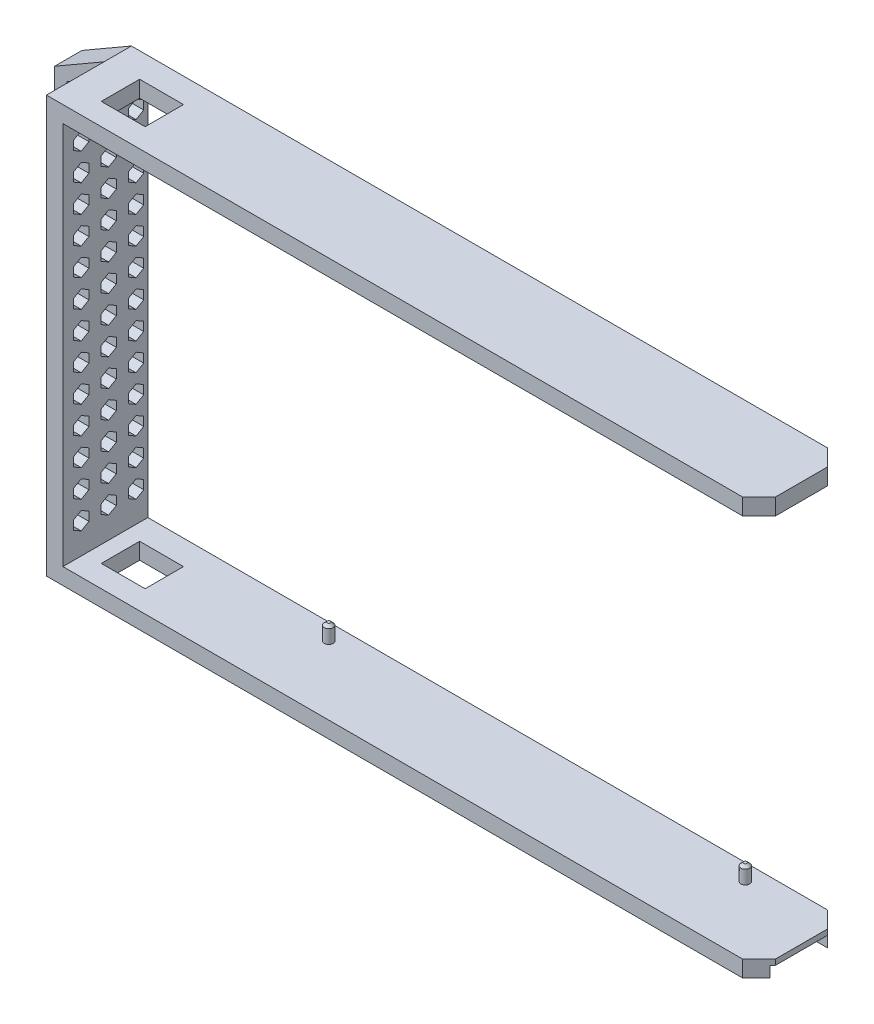
from build123d import *

# Parameters (mm, degrees)
SKETCH1_W           = 127
SKETCH1_H           = 3
SKETCH1_W_2         = 3
SKETCH1_H_2         = 70
BOSS_EXTRUDE1_DEPTH = 15.5
SKETCH2_W           = 22
SKETCH2_H           = 10
CUT_EXTRUDE1_DEPTH  = 2
CHAMFER5_SIZE       = 2
SKETCH3_W           = 2
SKETCH3_H           = 2.5
BOSS_EXTRUDE2_DEPTH = 3
CHAMFER9_SIZE       = 3
CHAMFER10_SIZE      = 3
CHAMFER11_SIZE      = 3
CHAMFER12_SIZE      = 3
SKETCH4_W           = 8
SKETCH4_H           = 7
CUT_EXTRUDE3_DEPTH  = 143
SKETCH10_R          = 0.8
BOSS_EXTRUDE5_DEPTH = 73
SKETCH14_R          = 0.8
BOSS_EXTRUDE6_DEPTH = 73
SKETCH15_W          = 11.145402024
SKETCH15_H          = 32
SKETCH15_W_2        = 9.53887415
CUT_EXTRUDE7_DEPTH  = 73
CHAMFER15_SIZE      = 0.5
CHAMFER16_SIZE      = 0.5
CUT_EXTRUDE8_DEPTH  = 73
BOSS_EXTRUDE9_DEPTH = 5


with BuildPart() as part:
    # Sketch1 → Boss-Extrude1 (new body)
    with BuildSketch(Plane.XY):
        with Locations((66.5, 74.5)):
            Rectangle(SKETCH1_W, SKETCH1_H)
        with Locations((1.5, 74.5)):
            Rectangle(SKETCH1_W_2, SKETCH1_H)
        with Locations((1.5, 38)):
            Rectangle(SKETCH1_W_2, SKETCH1_H_2)
        with Locations((1.5, 1.5)):
            Rectangle(SKETCH1_W_2, SKETCH1_H)
        with Locations((66.5, 1.5)):
            Rectangle(SKETCH1_W, SKETCH1_H)
    extrude(amount=BOSS_EXTRUDE1_DEPTH)

    # Sketch2 → Cut-Extrude1 (cut)
    with BuildSketch(Plane.XZ):
        with Locations((119, 8)):
            Rectangle(SKETCH2_W, SKETCH2_H)
    extrude(amount=-CUT_EXTRUDE1_DEPTH, mode=Mode.SUBTRACT)

    # Chamfer5
    chamfer5_edges = [part.edges().sort_by_distance(p)[0] for p in [
        (130, 1.5, 0),
    ]]
    chamfer(chamfer5_edges, length=CHAMFER5_SIZE)

    # Sketch3 → Boss-Extrude2 (add)
    with BuildSketch(Plane.XZ):
        with Locations((129, 1.25)):
            Rectangle(SKETCH3_W, SKETCH3_H)
    extrude(amount=-BOSS_EXTRUDE2_DEPTH)

    # Chamfer9
    chamfer9_edges = [part.edges().sort_by_distance(p)[0] for p in [
        (130, 1.5, 0),
    ]]
    chamfer(chamfer9_edges, length=CHAMFER9_SIZE)

    # Chamfer10
    chamfer10_edges = [part.edges().sort_by_distance(p)[0] for p in [
        (130, 1.5, 15.5),
    ]]
    chamfer(chamfer10_edges, length=CHAMFER10_SIZE)

    # Chamfer11
    chamfer11_edges = [part.edges().sort_by_distance(p)[0] for p in [
        (130, 74.5, 0),
    ]]
    chamfer(chamfer11_edges, length=CHAMFER11_SIZE)

    # Chamfer12
    chamfer12_edges = [part.edges().sort_by_distance(p)[0] for p in [
        (130, 74.5, 15.5),
    ]]
    chamfer(chamfer12_edges, length=CHAMFER12_SIZE)

    # Sketch4 → Cut-Extrude3 (cut)
    with BuildSketch(Plane(origin=(0, 76, 0), x_dir=(1, 0, 0), z_dir=(0, 1, 0))):
        with Locations((10, -8)):
            Rectangle(SKETCH4_W, SKETCH4_H)
    extrude(amount=-CUT_EXTRUDE3_DEPTH, mode=Mode.SUBTRACT)

    # Sketch10 → Boss-Extrude5 (add)
    with BuildSketch(Plane(origin=(0, 76, 0), x_dir=(1, 0, 0), z_dir=(0, 1, 0))):
        with Locations(Location((115, -3, 0), (0, 0, 270))):
            Circle(SKETCH10_R)
    extrude(amount=-BOSS_EXTRUDE5_DEPTH)

    # Sketch14 → Boss-Extrude6 (add)
    with BuildSketch(Plane(origin=(0, 76, 0), x_dir=(1, 0, 0), z_dir=(0, 1, 0))):
        with Locations(Location((39, -3, 0), (0, 0, 270))):
            Circle(SKETCH14_R)
    extrude(amount=-BOSS_EXTRUDE6_DEPTH)

    # Sketch15 → Cut-Extrude7 (cut)
    with BuildSketch(Plane.XY.offset(15.5)):
        Polygon((76.763159947, 70), (76.763159947, 38), (109.117804389, 38), (115.919411593, 38), (115.919411593, 70), align=None)
        with Locations((121.492112605, 54)):
            Rectangle(SKETCH15_W, SKETCH15_H)
        Polygon((115.919411593, 38), (109.117804389, 38), (109.117804389, 6), (132.054107066, 6), (132.054107066, 38), (127.064813617, 38), align=None)
        with Locations((42.280701989, 22)):
            Rectangle(SKETCH15_W_2, SKETCH15_H)
        Polygon((32.787793961, 70), (32.787793961, 38), (37.511264914, 38), (47.050139064, 38), (50.979613108, 38), (50.979613108, 70), align=None)
    extrude(amount=-CUT_EXTRUDE7_DEPTH, mode=Mode.SUBTRACT)

    # Chamfer15
    chamfer15_edges = [part.edges().sort_by_distance(p)[0] for p in [
        (39, 6, 2.2),
    ]]
    chamfer(chamfer15_edges, length=CHAMFER15_SIZE)

    # Chamfer16
    chamfer16_edges = [part.edges().sort_by_distance(p)[0] for p in [
        (115, 6, 2.2),
        (115, 70, 2.2),
        (39, 70, 2.2),
    ]]
    chamfer(chamfer16_edges, length=CHAMFER16_SIZE)

    # Sketch16 → Cut-Extrude8 (cut)
    with BuildSketch(Plane.ZY):
        Polygon((7.158237983, 66.958772445), (8.560962608, 67.768635885), (8.560962608, 69.388362766), (7.158237983, 70.198226206), (5.755513357, 69.388362766), (5.755513357, 67.768635885), align=None)
        Polygon((12.158237983, 66.958772445), (13.560962608, 67.768635885), (13.560962608, 69.388362766), (12.158237983, 70.198226206), (10.755513357, 69.388362766), (10.755513357, 67.768635885), align=None)
        Polygon((2.158237983, 66.958772445), (3.560962608, 67.768635885), (3.560962608, 69.388362766), (2.158237983, 70.198226206), (0.755513357, 69.388362766), (0.755513357, 67.768635885), align=None)
        Polygon((7.158237983, 61.958781256), (8.560962608, 62.768644696), (8.560962608, 64.388371576), (7.158237983, 65.198235016), (5.755513357, 64.388371576), (5.755513357, 62.768644696), align=None)
        Polygon((2.158237983, 61.958781256), (3.560962608, 62.768644696), (3.560962608, 64.388371576), (2.158237983, 65.198235016), (0.755513357, 64.388371576), (0.755513357, 62.768644696), align=None)
        Polygon((7.158237983, 56.958790066), (8.560962608, 57.768653506), (8.560962608, 59.388380387), (7.158237983, 60.198243827), (5.755513357, 59.388380387), (5.755513357, 57.768653506), align=None)
        Polygon((2.158237983, 56.958790066), (3.560962608, 57.768653506), (3.560962608, 59.388380387), (2.158237983, 60.198243827), (0.755513357, 59.388380387), (0.755513357, 57.768653506), align=None)
        Polygon((7.158237983, 51.958798877), (8.560962608, 52.768662317), (8.560962608, 54.388389197), (7.158237983, 55.198252637), (5.755513357, 54.388389197), (5.755513357, 52.768662317), align=None)
        Polygon((2.158237983, 51.958798877), (3.560962608, 52.768662317), (3.560962608, 54.388389197), (2.158237983, 55.198252637), (0.755513357, 54.388389197), (0.755513357, 52.768662317), align=None)
        Polygon((7.158237983, 46.958807687), (8.560962608, 47.768671127), (8.560962608, 49.388398007), (7.158237983, 50.198261448), (5.755513357, 49.388398007), (5.755513357, 47.768671127), align=None)
        Polygon((2.158237983, 46.958807687), (3.560962608, 47.768671127), (3.560962608, 49.388398007), (2.158237983, 50.198261448), (0.755513357, 49.388398007), (0.755513357, 47.768671127), align=None)
        Polygon((7.158237983, 41.958816497), (8.560962608, 42.768679937), (8.560962608, 44.388406818), (7.158237983, 45.198270258), (5.755513357, 44.388406818), (5.755513357, 42.768679937), align=None)
        Polygon((2.158237983, 41.958816497), (3.560962608, 42.768679937), (3.560962608, 44.388406818), (2.158237983, 45.198270258), (0.755513357, 44.388406818), (0.755513357, 42.768679937), align=None)
        Polygon((7.158237983, 36.958825308), (8.560962608, 37.768688748), (8.560962608, 39.388415628), (7.158237983, 40.198279068), (5.755513357, 39.388415628), (5.755513357, 37.768688748), align=None)
        Polygon((2.158237983, 36.958825308), (3.560962608, 37.768688748), (3.560962608, 39.388415628), (2.158237983, 40.198279068), (0.755513357, 39.388415628), (0.755513357, 37.768688748), align=None)
        Polygon((7.158237983, 31.958834118), (8.560962608, 32.768697558), (8.560962608, 34.388424439), (7.158237983, 35.198287879), (5.755513357, 34.388424439), (5.755513357, 32.768697558), align=None)
        Polygon((2.158237983, 31.958834118), (3.560962608, 32.768697558), (3.560962608, 34.388424439), (2.158237983, 35.198287879), (0.755513357, 34.388424439), (0.755513357, 32.768697558), align=None)
        Polygon((7.158237983, 26.958842929), (8.560962608, 27.768706369), (8.560962608, 29.388433249), (7.158237983, 30.198296689), (5.755513357, 29.388433249), (5.755513357, 27.768706369), align=None)
        Polygon((2.158237983, 26.958842929), (3.560962608, 27.768706369), (3.560962608, 29.388433249), (2.158237983, 30.198296689), (0.755513357, 29.388433249), (0.755513357, 27.768706369), align=None)
        Polygon((7.158237983, 21.958851739), (8.560962608, 22.768715179), (8.560962608, 24.388442059), (7.158237983, 25.1983055), (5.755513357, 24.388442059), (5.755513357, 22.768715179), align=None)
        Polygon((2.158237983, 21.958851739), (3.560962608, 22.768715179), (3.560962608, 24.388442059), (2.158237983, 25.1983055), (0.755513357, 24.388442059), (0.755513357, 22.768715179), align=None)
        Polygon((7.158237983, 16.958860549), (8.560962608, 17.768723989), (8.560962608, 19.38845087), (7.158237983, 20.19831431), (5.755513357, 19.38845087), (5.755513357, 17.768723989), align=None)
        Polygon((2.158237983, 16.958860549), (3.560962608, 17.768723989), (3.560962608, 19.38845087), (2.158237983, 20.19831431), (0.755513357, 19.38845087), (0.755513357, 17.768723989), align=None)
        Polygon((7.158237983, 11.95886936), (8.560962608, 12.7687328), (8.560962608, 14.38845968), (7.158237983, 15.19832312), (5.755513357, 14.38845968), (5.755513357, 12.7687328), align=None)
        Polygon((2.158237983, 11.95886936), (3.560962608, 12.7687328), (3.560962608, 14.38845968), (2.158237983, 15.19832312), (0.755513357, 14.38845968), (0.755513357, 12.7687328), align=None)
        Polygon((7.158237983, 6.95887817), (8.560962608, 7.76874161), (8.560962608, 9.388468491), (7.158237983, 10.198331931), (5.755513357, 9.388468491), (5.755513357, 7.76874161), align=None)
        Polygon((2.158237983, 6.95887817), (3.560962608, 7.76874161), (3.560962608, 9.388468491), (2.158237983, 10.198331931), (0.755513357, 9.388468491), (0.755513357, 7.76874161), align=None)
        Polygon((12.158237983, 61.958781256), (13.560962608, 62.768644696), (13.560962608, 64.388371576), (12.158237983, 65.198235016), (10.755513357, 64.388371576), (10.755513357, 62.768644696), align=None)
        Polygon((12.158237983, 56.958790066), (13.560962608, 57.768653506), (13.560962608, 59.388380387), (12.158237983, 60.198243827), (10.755513357, 59.388380387), (10.755513357, 57.768653506), align=None)
        Polygon((12.158237983, 51.958798877), (13.560962608, 52.768662317), (13.560962608, 54.388389197), (12.158237983, 55.198252637), (10.755513357, 54.388389197), (10.755513357, 52.768662317), align=None)
        Polygon((12.158237983, 46.958807687), (13.560962608, 47.768671127), (13.560962608, 49.388398007), (12.158237983, 50.198261448), (10.755513357, 49.388398007), (10.755513357, 47.768671127), align=None)
        Polygon((12.158237983, 41.958816497), (13.560962608, 42.768679937), (13.560962608, 44.388406818), (12.158237983, 45.198270258), (10.755513357, 44.388406818), (10.755513357, 42.768679937), align=None)
        Polygon((12.158237983, 36.958825308), (13.560962608, 37.768688748), (13.560962608, 39.388415628), (12.158237983, 40.198279068), (10.755513357, 39.388415628), (10.755513357, 37.768688748), align=None)
        Polygon((12.158237983, 31.958834118), (13.560962608, 32.768697558), (13.560962608, 34.388424439), (12.158237983, 35.198287879), (10.755513357, 34.388424439), (10.755513357, 32.768697558), align=None)
        Polygon((12.158237983, 26.958842929), (13.560962608, 27.768706369), (13.560962608, 29.388433249), (12.158237983, 30.198296689), (10.755513357, 29.388433249), (10.755513357, 27.768706369), align=None)
        Polygon((12.158237983, 21.958851739), (13.560962608, 22.768715179), (13.560962608, 24.388442059), (12.158237983, 25.1983055), (10.755513357, 24.388442059), (10.755513357, 22.768715179), align=None)
        Polygon((12.158237983, 16.958860549), (13.560962608, 17.768723989), (13.560962608, 19.38845087), (12.158237983, 20.19831431), (10.755513357, 19.38845087), (10.755513357, 17.768723989), align=None)
        Polygon((12.158237983, 11.95886936), (13.560962608, 12.7687328), (13.560962608, 14.38845968), (12.158237983, 15.19832312), (10.755513357, 14.38845968), (10.755513357, 12.7687328), align=None)
        Polygon((12.158237983, 6.95887817), (13.560962608, 7.76874161), (13.560962608, 9.388468491), (12.158237983, 10.198331931), (10.755513357, 9.388468491), (10.755513357, 7.76874161), align=None)
    extrude(amount=-CUT_EXTRUDE8_DEPTH, mode=Mode.SUBTRACT)

    # Sketch18 → Boss-Extrude9 (add)
    with BuildSketch(Plane.XY):
        Polygon((0, 57.773427516), (0, 55.169631447), (-9.019814169, 60.377223585), (-9.019814169, 70.792407862), (0, 76), (0, 73.396203931), (-6.764860627, 69.490509827), (-6.764860627, 61.67912162), align=None)
        Polygon((0, 0), (-9.019814169, 5.207592138), (-9.019814169, 15.622776415), (0, 20.830368553), (0, 18.226572484), (-6.764860627, 14.32087838), (-6.764860627, 6.509490173), (0, 2.603796069), align=None)
    extrude(amount=BOSS_EXTRUDE9_DEPTH)


solid = part.part
